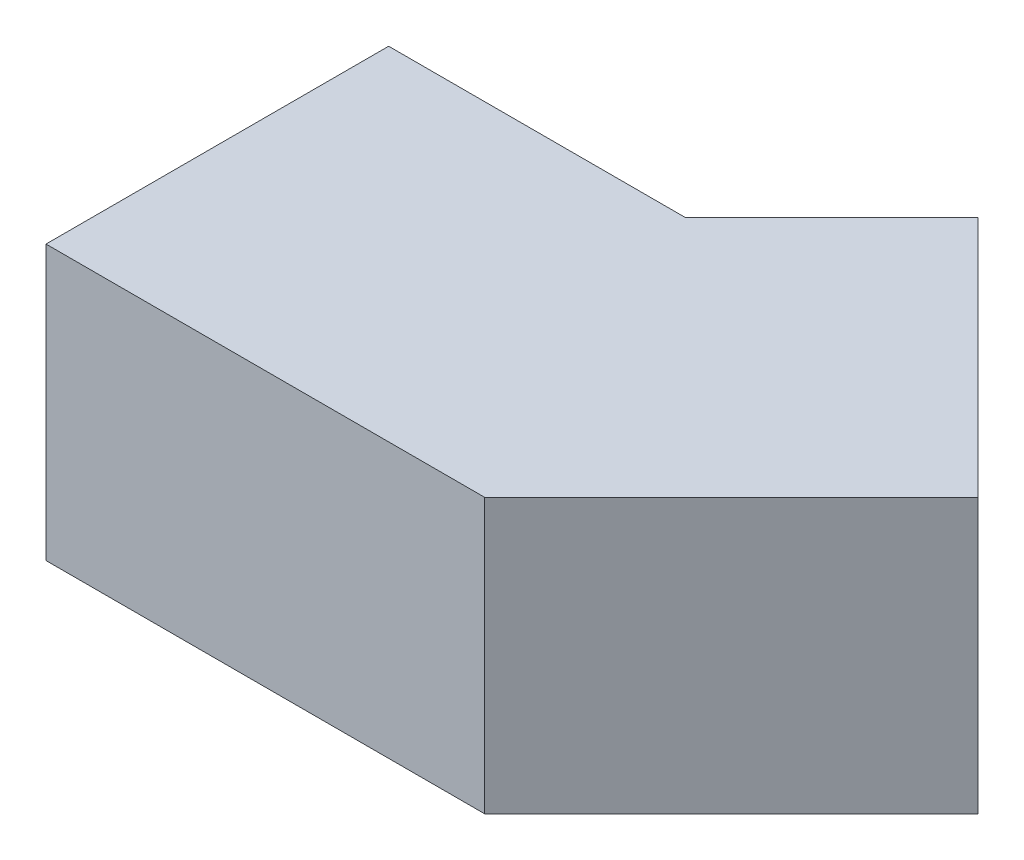
from build123d import *

# Parameters (mm, degrees)
BOSS_EXTRUDE1_DEPTH = 20


with BuildPart() as part:
    # Sketch1 → Boss-Extrude1 (new body)
    with BuildSketch(Plane(origin=(0, 0, 0), x_dir=(1, 0, 0), z_dir=(0, 1, 0))):
        Polygon((0, 0), (32, 0), (50, 18), (32.32233047, 35.67766953), (21.644660941, 25), (0, 25), align=None)
    extrude(amount=BOSS_EXTRUDE1_DEPTH)


solid = part.part
